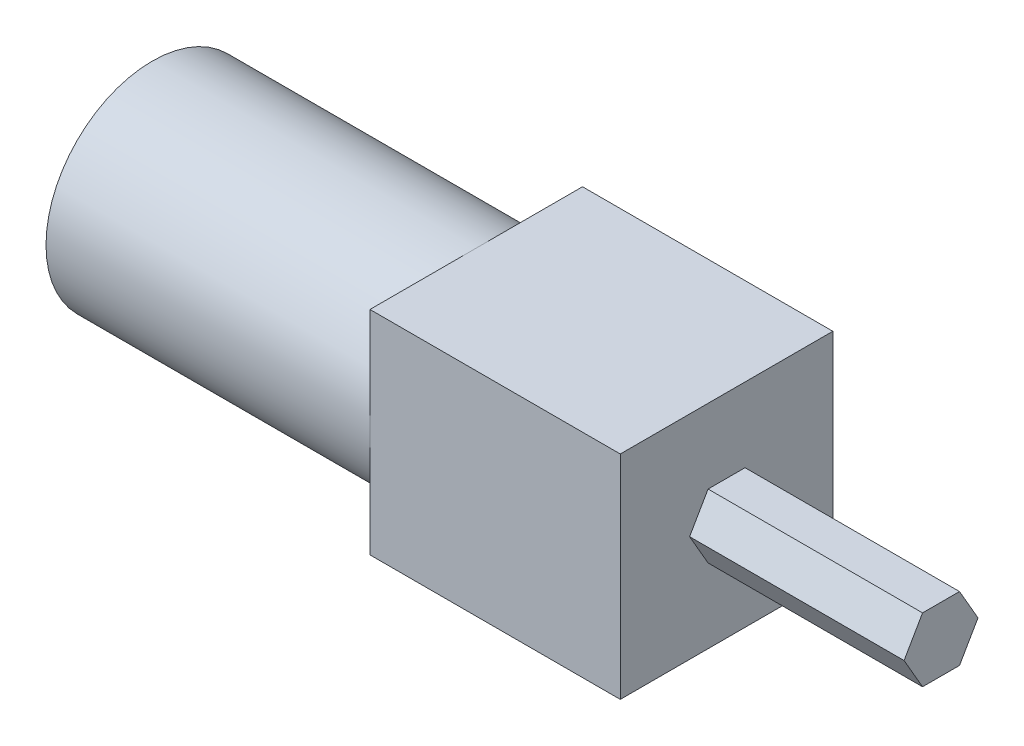
from build123d import *

# Parameters (mm, degrees)
SKETCH1_R           = 21.082
BOSS_EXTRUDE1_DEPTH = 64.262
SKETCH2_W           = 42.164
SKETCH2_H           = 42.164
BOSS_EXTRUDE2_DEPTH = 49.657
BOSS_EXTRUDE3_DEPTH = 42.545


with BuildPart() as part:
    # Sketch1 → Boss-Extrude1 (new body)
    with BuildSketch(Plane(origin=(0, 0, 0), x_dir=(0, 0, -1), z_dir=(1, 0, 0))):
        Circle(SKETCH1_R)
    extrude(amount=BOSS_EXTRUDE1_DEPTH)

    # Sketch2 → Boss-Extrude2 (add)
    with BuildSketch(Plane(origin=(64.262, 0, 0), x_dir=(0, 0, -1), z_dir=(1, 0, 0))):
        Rectangle(SKETCH2_W, SKETCH2_H)
    extrude(amount=BOSS_EXTRUDE2_DEPTH)

    # Sketch3 → Boss-Extrude3 (add)
    with BuildSketch(Plane(origin=(113.919, 0, 0), x_dir=(0, 0, -1), z_dir=(1, 0, 0))):
        Polygon((7.332348419, 0), (3.666174209, 6.35), (-3.666174209, 6.35), (-7.332348419, 0), (-3.666174209, -6.35), (3.666174209, -6.35), align=None)
    extrude(amount=BOSS_EXTRUDE3_DEPTH)


solid = part.part
